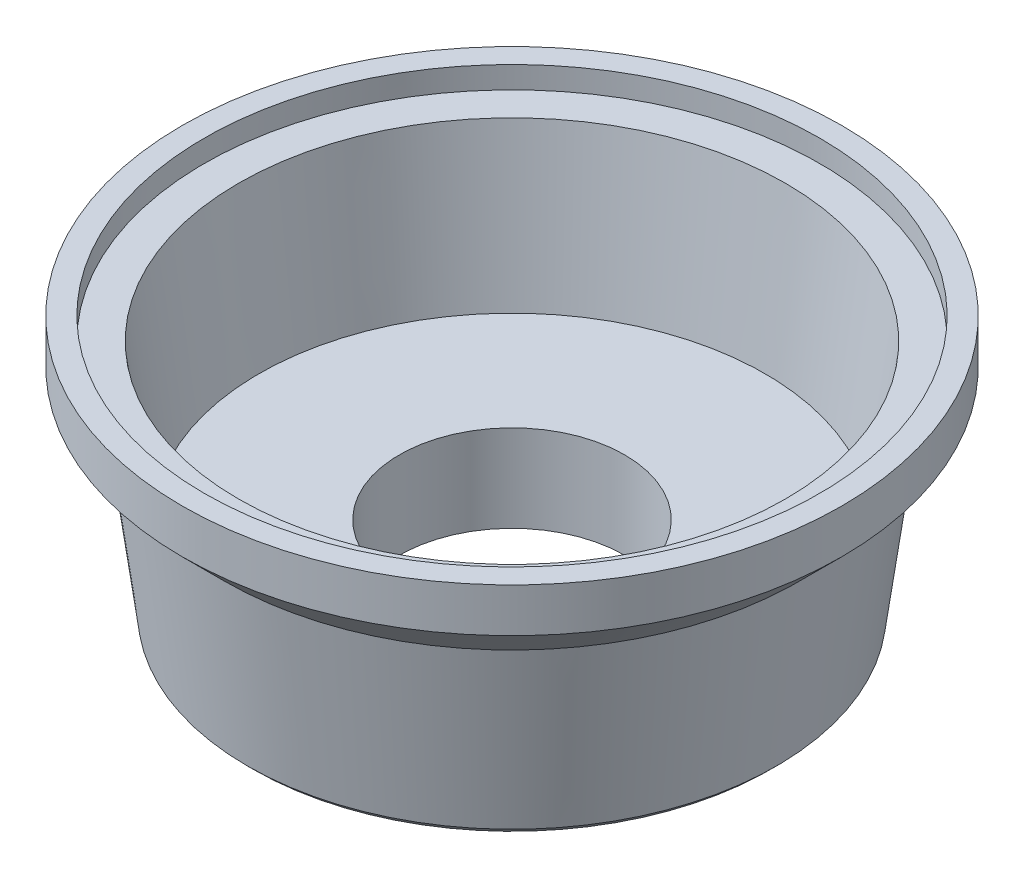
from build123d import *
from OCP.BRepFilletAPI import BRepFilletAPI_MakeChamfer

# Parameters (mm, degrees)
SHELL1_T           = -3.175
SKETCH3_R          = 16.27124
CUT_EXTRUDE1_DEPTH = 73.027519701
SHELL3_T           = -3.175
CHAMFER1_SIZE      = 0.762
CHAMFER1_SIZE2     = 0.885421272


with BuildPart() as part:
    # Sketch1 → Revolve2 (revolve)
    with BuildSketch(Plane(origin=(0, 0, 0), x_dir=(0, 0, -1), z_dir=(1, 0, 0)), mode=Mode.PRIVATE) as revolve2_sk:
        Polygon((0, 0), (38.1, 0), (42.288930477, 31.75), (47.625, 31.75), (47.625, 38.1), (0, 38.1), align=None)
    revolve(revolve2_sk.sketch.rotate(Axis((0, 0, 0), (0, -1, 0)), 180), axis=Axis((0, 0, 0), (0, -1, 0)))

    # Shell1
    shell1_openings = [part.faces().sort_by_distance(p)[0] for p in [
        (0, 38.1, 0),
    ]]
    offset(amount=SHELL1_T, openings=shell1_openings, kind=Kind.INTERSECTION)

    # Sketch2 → Revolve3 (revolve)
    with BuildSketch(Plane.XY, mode=Mode.PRIVATE) as revolve3_sk:
        Polygon((-37.277313556, 12.571930266), (0, 12.571930266), (0, 1.888797723), (-36.368110787, 1.888797723), align=None)
    revolve(revolve3_sk.sketch.rotate(Axis((0, 0, 0), (0, -1, 0)), 270), axis=Axis((0, 0, 0), (0, -1, 0)))

    # Sketch3 → Cut-Extrude1 (cut, through all)
    with BuildSketch(Plane(origin=(0, 12.571930266, 0), x_dir=(1, 0, 0), z_dir=(0, 1, 0))):
        with Locations(Location((0, 0, 0), (0, 0, 270))):
            Circle(SKETCH3_R)
    extrude(amount=-CUT_EXTRUDE1_DEPTH, mode=Mode.SUBTRACT)

    # Shell3
    shell3_openings = [part.faces().sort_by_distance(p)[0] for p in [
        (0, 0, -37.022369265),
    ]]
    offset(amount=SHELL3_T, openings=shell3_openings, kind=Kind.INTERSECTION)

    # Sketch4 → Revolve4 (revolve)
    with BuildSketch(Plane.XY, mode=Mode.PRIVATE) as revolve4_sk:
        Polygon((-47.625, 31.75), (-40.729010951, 24.854010951), (-40.729010951, 32.355083401), (-47.625, 32.355083401), align=None)
    revolve(revolve4_sk.sketch.rotate(Axis((0, 0, 0), (0, 1, 0)), 90), axis=Axis((0, 0, 0), (0, 1, 0)))

    # Chamfer1: one chamfer whose edges measure the first distance from different faces: ONE call of the kernel's chamfer builder (chamfer() names one face for all edges)
    chamfer1_edges_1 = [part.edges().sort_by_distance(p)[0] for p in [
        (0, 0, -19.44624),
    ]]
    chamfer1_edges_2 = [part.edges().sort_by_distance(p)[0] for p in [
        (0, 0, -38.1),
    ]]
    chamfer1_side_2 = [part.faces().sort_by_distance(p)[0] for p in [
        (0, 0, -35.975116662),
    ]]
    chamfer1 = BRepFilletAPI_MakeChamfer(part.part.solid().wrapped)
    for e in chamfer1_edges_1:
        chamfer1.Add(CHAMFER1_SIZE, e.wrapped)
    for e in chamfer1_edges_2:
        chamfer1.Add(CHAMFER1_SIZE, CHAMFER1_SIZE2, e.wrapped, chamfer1_side_2[0].wrapped)  # the first distance lies on this face
    add(Compound.cast(chamfer1.Shape()), mode=Mode.REPLACE)


solid = part.part
